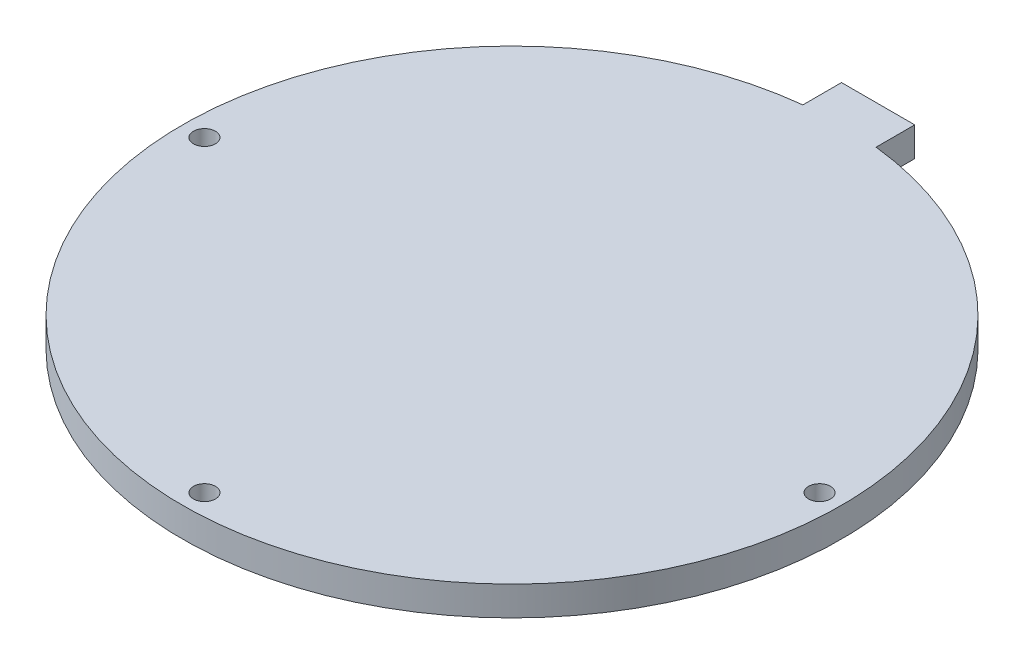
from build123d import *

# Parameters (mm, degrees)
SKETCH_1_R      = 1.5
EXTRUDE_1_DEPTH = 4


with BuildPart() as part:
    # 草图1 → 凸台-拉伸1 (new body)
    with BuildSketch(Plane(origin=(0, 0, 0), x_dir=(1, 0, 0), z_dir=(0, 1, 0))):
        with BuildLine():
            Line((-5, 50), (5, 50))
            Line((5, 50), (5, 44.72135955))
            ThreePointArc((5, 44.72135955), (0, -45), (-5, 44.72135955))
            Line((-5, 44.72135955), (-5, 50))
        make_face()
        with Locations(Location((-42, 0, 0), (0, 0, 270))):
            Circle(SKETCH_1_R, mode=Mode.SUBTRACT)
        with Locations(Location((42, 0, 0), (0, 0, 270))):
            Circle(SKETCH_1_R, mode=Mode.SUBTRACT)
        with Locations(Location((0, -42, 0), (0, 0, 270))):
            Circle(SKETCH_1_R, mode=Mode.SUBTRACT)
    extrude(amount=EXTRUDE_1_DEPTH)


solid = part.part
